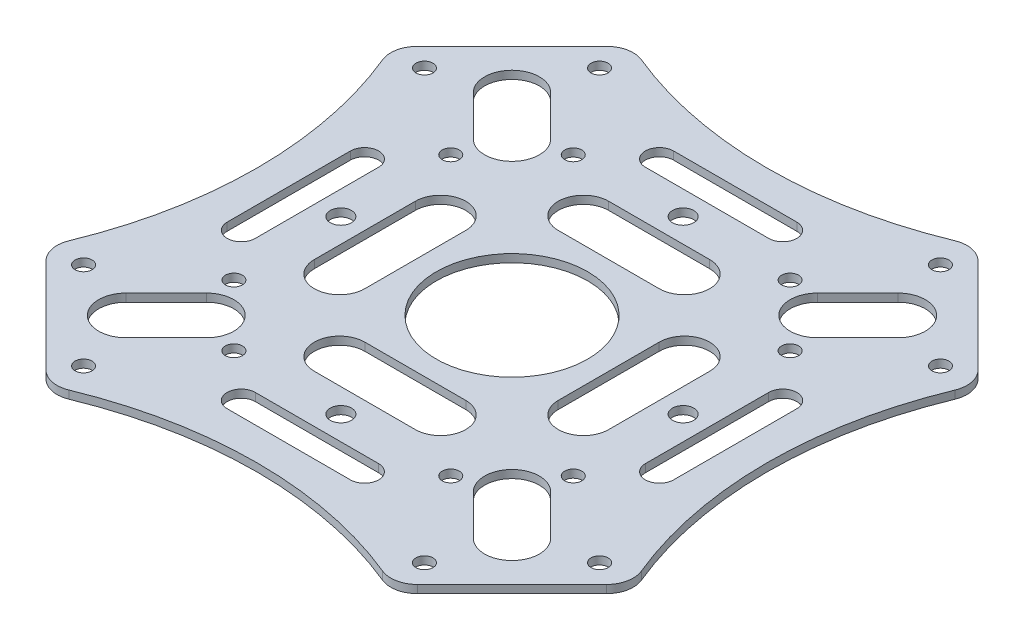
from build123d import *

# Parameters (mm, degrees)
SKETCH1_R           = 14.25
SKETCH1_R_2         = 2
SKETCH1_R_3         = 1.6
BOSS_EXTRUDE1_DEPTH = 0.75


with BuildPart() as part:
    # Sketch1 → Boss-Extrude1 (new, symmetric)
    with BuildSketch(Plane(origin=(0, 0, 0), x_dir=(1, 0, 0), z_dir=(0, 1, 0))):
        with BuildLine():
            Line((-34.937302436, 52.743938431), (-52.743938431, 34.937302436))
            ThreePointArc((-52.743938431, 34.937302436), (-54.111197998, 32.382898574), (-53.832221535, 29.499055662))
            ThreePointArc((-53.832221535, 29.499055662), (-48, 0), (-53.832221535, -29.499055662))
            ThreePointArc((-53.832221535, -29.499055662), (-54.111197998, -32.382898574), (-52.743938431, -34.937302436))
            Line((-52.743938431, -34.937302436), (-34.937302436, -52.743938431))
            ThreePointArc((-34.937302436, -52.743938431), (-32.382898574, -54.111197998), (-29.499055662, -53.832221535))
            ThreePointArc((-29.499055662, -53.832221535), (0, -48), (29.499055662, -53.832221535))
            ThreePointArc((29.499055662, -53.832221535), (32.382898574, -54.111197998), (34.937302436, -52.743938431))
            Line((34.937302436, -52.743938431), (52.743938431, -34.937302436))
            ThreePointArc((52.743938431, -34.937302436), (54.111197998, -32.382898574), (53.832221535, -29.499055662))
            ThreePointArc((53.832221535, -29.499055662), (48, 0), (53.832221535, 29.499055662))
            ThreePointArc((53.832221535, 29.499055662), (54.111197998, 32.382898574), (52.743938431, 34.937302436))
            Line((52.743938431, 34.937302436), (34.937302436, 52.743938431))
            ThreePointArc((34.937302436, 52.743938431), (32.382898574, 54.111197998), (29.499055662, 53.832221535))
            ThreePointArc((29.499055662, 53.832221535), (0, 48), (-29.499055662, 53.832221535))
            ThreePointArc((-29.499055662, 53.832221535), (-32.382898574, 54.111197998), (-34.937302436, 52.743938431))
        make_face()
        with Locations(Location((0, 0, 0), (0, 0, 90))):
            Circle(SKETCH1_R, mode=Mode.SUBTRACT)
        with Locations(Location((-32.2, 0, 0), (0, 0, 90))):
            Circle(SKETCH1_R_2, mode=Mode.SUBTRACT)
        with Locations(Location((-20.400030637, 31.925871171, 0), (0, 0, 90))):
            Circle(SKETCH1_R_3, mode=Mode.SUBTRACT)
        with Locations(Location((-32.067292527, 48.542880528, 0), (0, 0, 90))):
            Circle(SKETCH1_R_3, mode=Mode.SUBTRACT)
        with Locations(Location((-31.925871171, -20.400030637, 0), (0, 0, 90))):
            Circle(SKETCH1_R_3, mode=Mode.SUBTRACT)
        with Locations(Location((-48.542880528, -32.067292527, 0), (0, 0, 90))):
            Circle(SKETCH1_R_3, mode=Mode.SUBTRACT)
        with Locations(Location((20.400030637, -31.925871171, 0), (0, 0, 90))):
            Circle(SKETCH1_R_3, mode=Mode.SUBTRACT)
        with Locations(Location((32.067292527, -48.542880528, 0), (0, 0, 90))):
            Circle(SKETCH1_R_3, mode=Mode.SUBTRACT)
        with Locations(Location((31.925871171, 20.400030637, 0), (0, 0, 90))):
            Circle(SKETCH1_R_3, mode=Mode.SUBTRACT)
        with Locations(Location((48.542880528, 32.067292527, 0), (0, 0, 90))):
            Circle(SKETCH1_R_3, mode=Mode.SUBTRACT)
        with Locations(Location((32.067292527, 48.542880528, 0), (0, 0, 90))):
            Circle(SKETCH1_R_3, mode=Mode.SUBTRACT)
        with Locations(Location((20.400030637, 31.925871171, 0), (0, 0, 90))):
            Circle(SKETCH1_R_3, mode=Mode.SUBTRACT)
        with Locations(Location((48.542880528, -32.067292527, 0), (0, 0, 90))):
            Circle(SKETCH1_R_3, mode=Mode.SUBTRACT)
        with Locations(Location((31.925871171, -20.400030637, 0), (0, 0, 90))):
            Circle(SKETCH1_R_3, mode=Mode.SUBTRACT)
        with Locations(Location((-32.067292527, -48.542880528, 0), (0, 0, 90))):
            Circle(SKETCH1_R_3, mode=Mode.SUBTRACT)
        with Locations(Location((-20.400030637, -31.925871171, 0), (0, 0, 90))):
            Circle(SKETCH1_R_3, mode=Mode.SUBTRACT)
        with Locations(Location((-48.542880528, 32.067292527, 0), (0, 0, 90))):
            Circle(SKETCH1_R_3, mode=Mode.SUBTRACT)
        with Locations(Location((-31.925871171, 20.400030637, 0), (0, 0, 90))):
            Circle(SKETCH1_R_3, mode=Mode.SUBTRACT)
        with Locations(Location((0, 32.2, 0), (0, 0, 90))):
            Circle(SKETCH1_R_2, mode=Mode.SUBTRACT)
        with Locations(Location((0, -32.2, 0), (0, 0, 90))):
            Circle(SKETCH1_R_2, mode=Mode.SUBTRACT)
        with Locations(Location((32.2, 0, 0), (0, 0, 90))):
            Circle(SKETCH1_R_2, mode=Mode.SUBTRACT)
        with BuildLine():
            Line((9.5, -27.7), (-9.5, -27.7))
            ThreePointArc((-9.5, -27.7), (-14.25, -22.95), (-9.5, -18.2))
            Line((-9.5, -18.2), (9.5, -18.2))
            ThreePointArc((9.5, -18.2), (14.25, -22.95), (9.5, -27.7))
        make_face(mode=Mode.SUBTRACT)
        with BuildLine():
            Line((11.6, -42), (-11.6, -42))
            ThreePointArc((-11.6, -42), (-14.25, -39.35), (-11.6, -36.7))
            Line((-11.6, -36.7), (11.6, -36.7))
            ThreePointArc((11.6, -36.7), (14.25, -39.35), (11.6, -42))
        make_face(mode=Mode.SUBTRACT)
        with BuildLine():
            Line((32.385490578, -25.102290732), (39.951533137, -32.668333291))
            ThreePointArc((39.951533137, -32.668333291), (39.951533137, -39.951533137), (32.668333291, -39.951533137))
            Line((32.668333291, -39.951533137), (25.102290732, -32.385490578))
            ThreePointArc((25.102290732, -32.385490578), (25.102290732, -25.102290732), (32.385490578, -25.102290732))
        make_face(mode=Mode.SUBTRACT)
        with BuildLine():
            Line((-9.5, 27.7), (9.5, 27.7))
            ThreePointArc((9.5, 27.7), (14.25, 22.95), (9.5, 18.2))
            Line((9.5, 18.2), (-9.5, 18.2))
            ThreePointArc((-9.5, 18.2), (-14.25, 22.95), (-9.5, 27.7))
        make_face(mode=Mode.SUBTRACT)
        with BuildLine():
            Line((-11.6, 42), (11.6, 42))
            ThreePointArc((11.6, 42), (14.25, 39.35), (11.6, 36.7))
            Line((11.6, 36.7), (-11.6, 36.7))
            ThreePointArc((-11.6, 36.7), (-14.25, 39.35), (-11.6, 42))
        make_face(mode=Mode.SUBTRACT)
        with BuildLine():
            Line((-32.385490578, 25.102290732), (-39.951533137, 32.668333291))
            ThreePointArc((-39.951533137, 32.668333291), (-39.951533137, 39.951533137), (-32.668333291, 39.951533137))
            Line((-32.668333291, 39.951533137), (-25.102290732, 32.385490578))
            ThreePointArc((-25.102290732, 32.385490578), (-25.102290732, 25.102290732), (-32.385490578, 25.102290732))
        make_face(mode=Mode.SUBTRACT)
        with BuildLine():
            Line((25.102290732, 32.385490578), (32.668333291, 39.951533137))
            ThreePointArc((32.668333291, 39.951533137), (39.951533137, 39.951533137), (39.951533137, 32.668333291))
            Line((39.951533137, 32.668333291), (32.385490578, 25.102290732))
            ThreePointArc((32.385490578, 25.102290732), (25.102290732, 25.102290732), (25.102290732, 32.385490578))
        make_face(mode=Mode.SUBTRACT)
        with BuildLine():
            Line((-25.102290732, -32.385490578), (-32.668333291, -39.951533137))
            ThreePointArc((-32.668333291, -39.951533137), (-39.951533137, -39.951533137), (-39.951533137, -32.668333291))
            Line((-39.951533137, -32.668333291), (-32.385490578, -25.102290732))
            ThreePointArc((-32.385490578, -25.102290732), (-25.102290732, -25.102290732), (-25.102290732, -32.385490578))
        make_face(mode=Mode.SUBTRACT)
        with BuildLine():
            Line((-42, -11.6), (-42, 11.6))
            ThreePointArc((-42, 11.6), (-39.35, 14.25), (-36.7, 11.6))
            Line((-36.7, 11.6), (-36.7, -11.6))
            ThreePointArc((-36.7, -11.6), (-39.35, -14.25), (-42, -11.6))
        make_face(mode=Mode.SUBTRACT)
        with BuildLine():
            Line((-27.7, -9.5), (-27.7, 9.5))
            ThreePointArc((-27.7, 9.5), (-22.95, 14.25), (-18.2, 9.5))
            Line((-18.2, 9.5), (-18.2, -9.5))
            ThreePointArc((-18.2, -9.5), (-22.95, -14.25), (-27.7, -9.5))
        make_face(mode=Mode.SUBTRACT)
        with BuildLine():
            Line((42, 11.6), (42, -11.6))
            ThreePointArc((42, -11.6), (39.35, -14.25), (36.7, -11.6))
            Line((36.7, -11.6), (36.7, 11.6))
            ThreePointArc((36.7, 11.6), (39.35, 14.25), (42, 11.6))
        make_face(mode=Mode.SUBTRACT)
        with BuildLine():
            Line((27.7, 9.5), (27.7, -9.5))
            ThreePointArc((27.7, -9.5), (22.95, -14.25), (18.2, -9.5))
            Line((18.2, -9.5), (18.2, 9.5))
            ThreePointArc((18.2, 9.5), (22.95, 14.25), (27.7, 9.5))
        make_face(mode=Mode.SUBTRACT)
    extrude(amount=BOSS_EXTRUDE1_DEPTH, both=True)


solid = part.part
